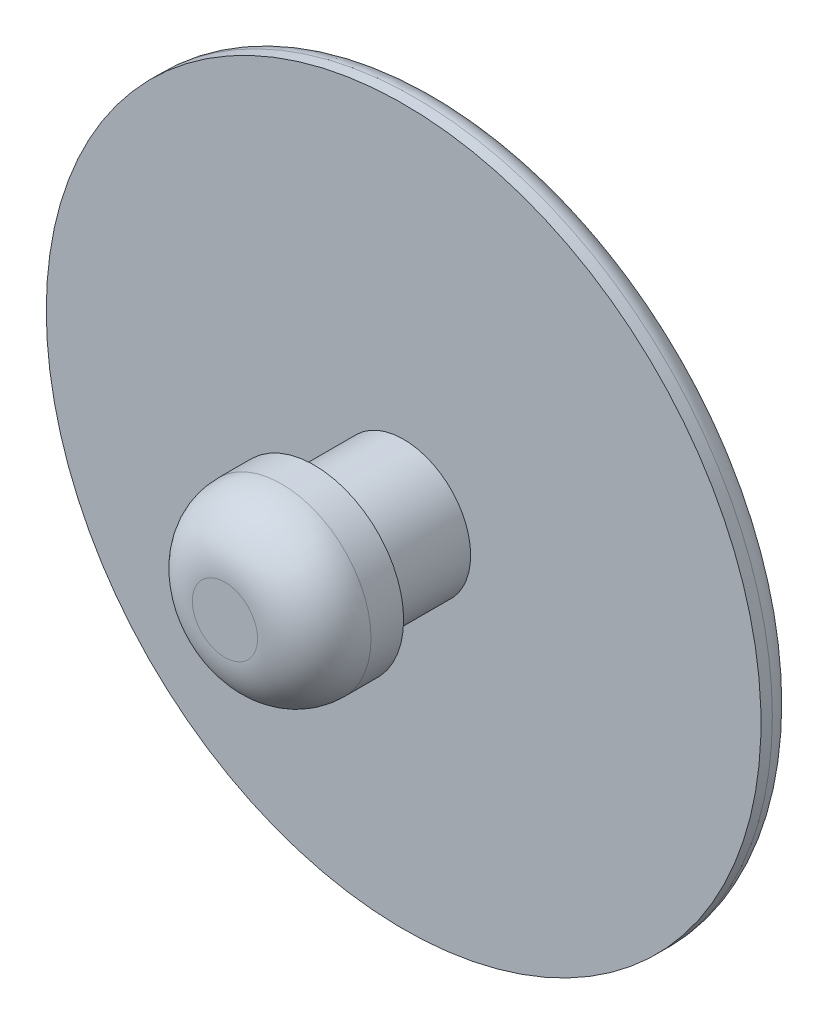
from build123d import *

# Parameters (mm, degrees)
SKETCH1_R           = 8
BOSS_EXTRUDE1_DEPTH = 0.762
FILLET1_R           = 0.508
SKETCH2_R           = 1.5
BOSS_EXTRUDE2_DEPTH = 2
SKETCH3_R           = 2
BOSS_EXTRUDE3_DEPTH = 2
FILLET2_R           = 1.27


with BuildPart() as part:
    # Sketch1 → Boss-Extrude1 (new body)
    with BuildSketch(Plane.XY):
        with Locations(Location((0, 0, 0), (0, 0, 180))):
            Circle(SKETCH1_R)
    extrude(amount=BOSS_EXTRUDE1_DEPTH)

    # Fillet1
    fillet1_edges = [part.edges().sort_by_distance(p)[0] for p in [
        (8, 0, 0),
    ]]
    fillet(fillet1_edges, radius=FILLET1_R)

    # Sketch2 → Boss-Extrude2 (add)
    with BuildSketch(Plane.XY.offset(0.762)):
        Circle(SKETCH2_R)
    extrude(amount=BOSS_EXTRUDE2_DEPTH)

    # Sketch3 → Boss-Extrude3 (add)
    with BuildSketch(Plane.XY.offset(2.762)):
        Circle(SKETCH3_R)
    extrude(amount=BOSS_EXTRUDE3_DEPTH)

    # Fillet2
    fillet2_edges = [part.edges().sort_by_distance(p)[0] for p in [
        (-2, 0, 4.762),
    ]]
    fillet(fillet2_edges, radius=FILLET2_R)


solid = part.part
